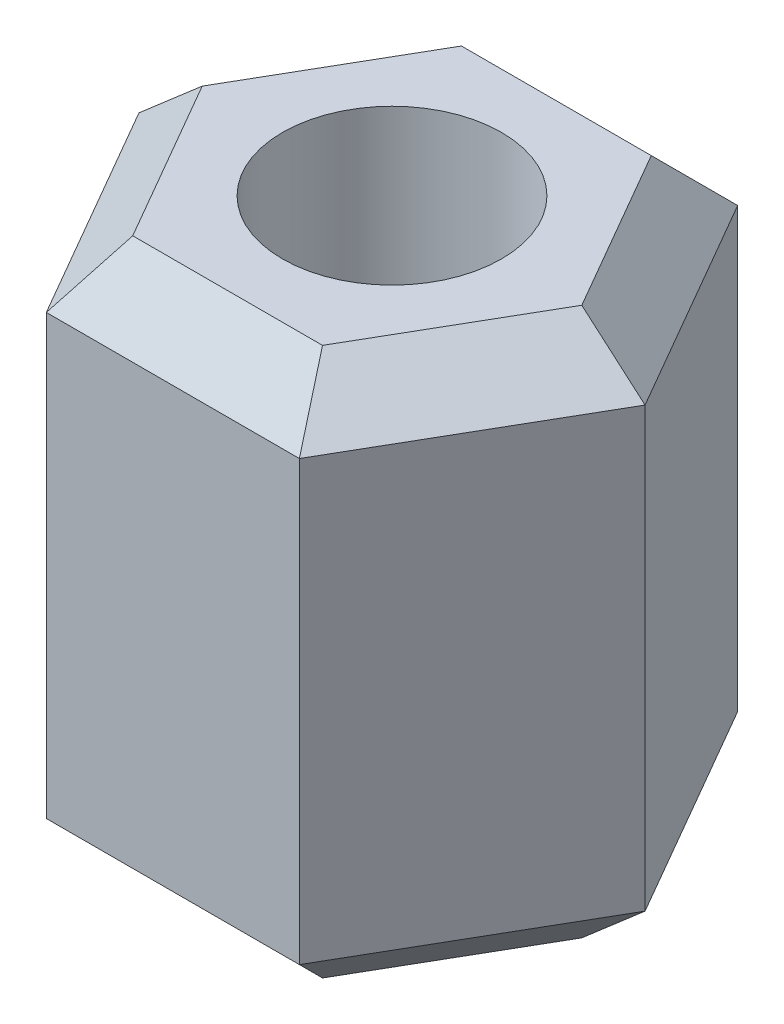
from build123d import *

# Parameters (mm, degrees)
SKETCH_1_R      = 1
EXTRUDE_1_DEPTH = 5
CHAMFER_1_SIZE  = 0.5


with BuildPart() as part:
    # 草图1 → 凸台-拉伸1 (new body)
    with BuildSketch(Plane(origin=(0, 0, 0), x_dir=(1, 0, 0), z_dir=(0, 1, 0))):
        Polygon((-2.309401077, 0), (-1.154700538, -2), (1.154700538, -2), (2.309401077, 0), (1.154700538, 2), (-1.154700538, 2), align=None)
        with Locations(Location((0, 0, 0), (0, 0, 270))):
            Circle(SKETCH_1_R, mode=Mode.SUBTRACT)
    extrude(amount=EXTRUDE_1_DEPTH)

    # 倒角1
    chamfer_1_edges = [part.edges().sort_by_distance(p)[0] for p in [
        (0, 5, 2),
        (1.732050808, 5, 1),
        (1.732050808, 5, -1),
        (0, 5, -2),
        (-1.732050808, 5, -1),
        (0, 0, -2),
        (1.732050808, 0, -1),
        (1.732050808, 0, 1),
        (0, 0, 2),
        (-1.732050808, 0, 1),
        (-1.732050808, 0, -1),
        (-1.732050808, 5, 1),
    ]]
    chamfer(chamfer_1_edges, length=CHAMFER_1_SIZE)


solid = part.part
